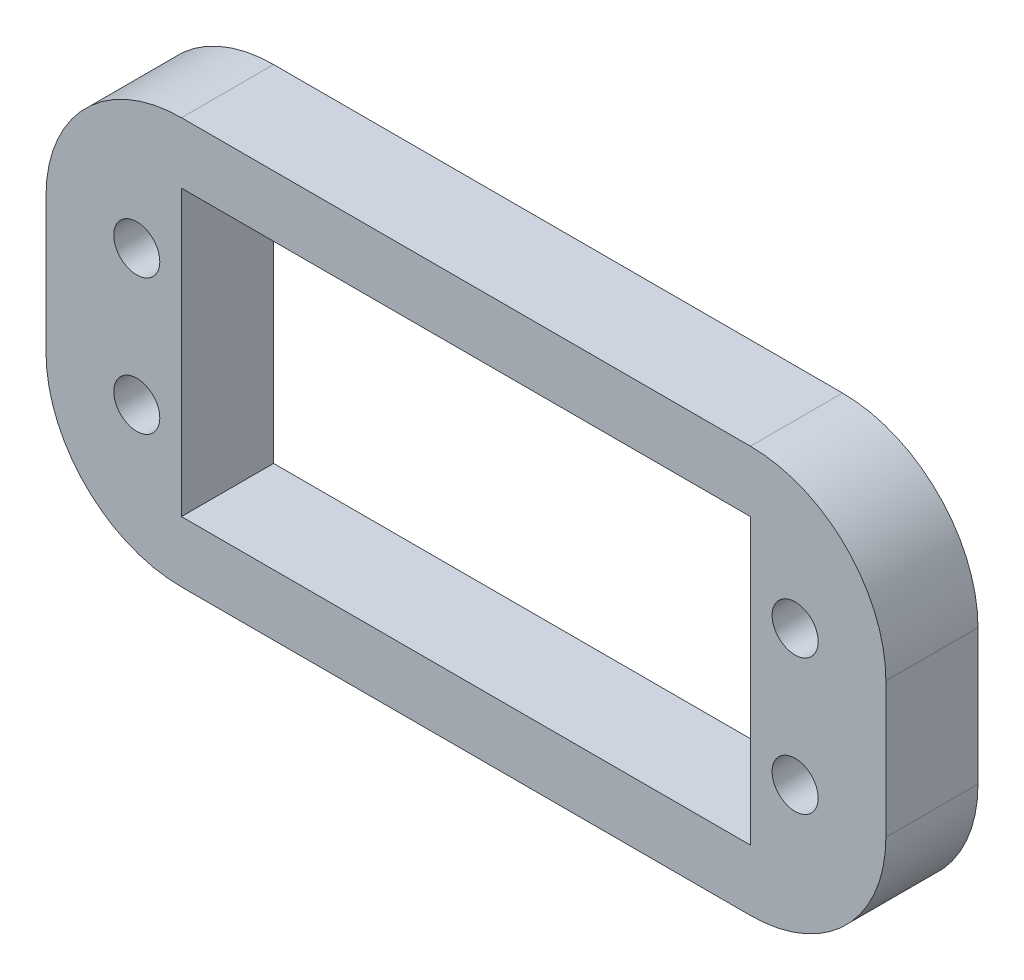
from build123d import *

# Parameters (mm, degrees)
SKETCH_1_W      = 62
SKETCH_1_H      = 30
SKETCH_1_R      = 1.7
SKETCH_1_W_2    = 42
SKETCH_1_H_2    = 21
EXTRUDE_1_DEPTH = 6.8
FILLET_1_R      = 10


with BuildPart() as part:
    # 草图1 → 凸台-拉伸1 (new body)
    with BuildSketch(Plane.XY):
        with Locations((31, 15)):
            Rectangle(SKETCH_1_W, SKETCH_1_H)
        with Locations((6.7, 20)):
            Circle(SKETCH_1_R, mode=Mode.SUBTRACT)
        with Locations((6.7, 10)):
            Circle(SKETCH_1_R, mode=Mode.SUBTRACT)
        with Locations(Location((55.3, 10, 0), (0, 0, 180))):
            Circle(SKETCH_1_R, mode=Mode.SUBTRACT)
        with Locations(Location((55.3, 20, 0), (0, 0, 180))):
            Circle(SKETCH_1_R, mode=Mode.SUBTRACT)
        with Locations((31, 15)):
            Rectangle(SKETCH_1_W_2, SKETCH_1_H_2, mode=Mode.SUBTRACT)
    extrude(amount=EXTRUDE_1_DEPTH)

    # 圆角1
    fillet_1_edges = [part.edges().sort_by_distance(p)[0] for p in [
        (0, 30, 3.4),
        (62, 30, 3.4),
        (62, 0, 3.4),
        (0, 0, 3.4),
    ]]
    fillet(fillet_1_edges, radius=FILLET_1_R)


solid = part.part
